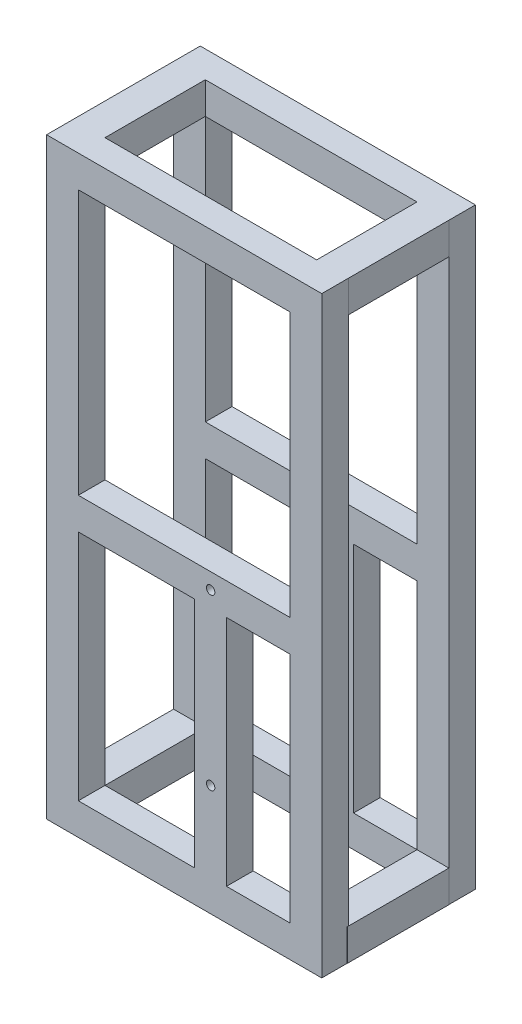
from build123d import *

# Parameters (mm, degrees)
ESQUISSE1_W                = 650
ESQUISSE1_H                = 1400
ESQUISSE1_W_2              = 275
ESQUISSE1_H_2              = 550
ESQUISSE1_W_3              = 150
ESQUISSE1_W_4              = 500
ESQUISSE1_H_3              = 625
BOSS_EXTRU_1_DEPTH         = 63
R_P_TITION_LIN_AIRE1_COUNT = 2
R_P_TITION_LIN_AIRE1_PITCH = 300
ESQUISSE2_W                = 75
ESQUISSE2_H                = 75
ESQUISSE2_W_2              = 75.286628514
ESQUISSE2_W_3              = 74.984214748
BOSS_EXTRU_2_DEPTH         = 240
ESQUISSE15_R               = 10
ENL_V_MAT_EXTRU_4_DEPTH    = 1586.76218243


with BuildPart() as part:
    # Esquisse1 → Boss.-Extru.1 (new body)
    with BuildSketch(Plane.XY):
        with Locations((325, 700)):
            Rectangle(ESQUISSE1_W, ESQUISSE1_H)
        with Locations((212.5, 350)):
            Rectangle(ESQUISSE1_W_2, ESQUISSE1_H_2, mode=Mode.SUBTRACT)
        with Locations((500, 350)):
            Rectangle(ESQUISSE1_W_3, ESQUISSE1_H_2, mode=Mode.SUBTRACT)
        with Locations((325, 1012.5)):
            Rectangle(ESQUISSE1_W_4, ESQUISSE1_H_3, mode=Mode.SUBTRACT)
    extrude(amount=BOSS_EXTRU_1_DEPTH)


with BuildPart() as r_p_tition_lin_aire1_1:
    # Répétition linéaire1: pattern copy
    add(part.part.moved(Location(Vector(0, 0, 1) * (1 * R_P_TITION_LIN_AIRE1_PITCH))))


with BuildPart() as part_1:
    add(part.part)

    add(r_p_tition_lin_aire1_1.part)  # Boss.-Extru.2 merges Répétition linéaire1_1
    # Esquisse2 → Boss.-Extru.2 (add)
    with BuildSketch(Plane.XY.offset(63)):
        with Locations((37.5, 37.5)):
            Rectangle(ESQUISSE2_W, ESQUISSE2_H)
        with Locations((612.643314257, 37.5)):
            Rectangle(ESQUISSE2_W_2, ESQUISSE2_H)
        with Locations((612.492107374, 1362.5)):
            Rectangle(ESQUISSE2_W_3, ESQUISSE2_H)
        with Locations((37.5, 1362.5)):
            Rectangle(ESQUISSE2_W, ESQUISSE2_H)
    extrude(amount=BOSS_EXTRU_2_DEPTH)

    # Esquisse15 → Enlèv. mat.-Extru.4 (cut, through all)
    with BuildSketch(Plane(origin=(0, 0, 0), x_dir=(-1, 0, 0), z_dir=(0, 0, -1))):
        with Locations((-387.5, 662.5)):
            Circle(ESQUISSE15_R)
        with Locations((-387.5, 262.5)):
            Circle(ESQUISSE15_R)
    extrude(amount=-ENL_V_MAT_EXTRU_4_DEPTH, mode=Mode.SUBTRACT)


solid = part_1.part
